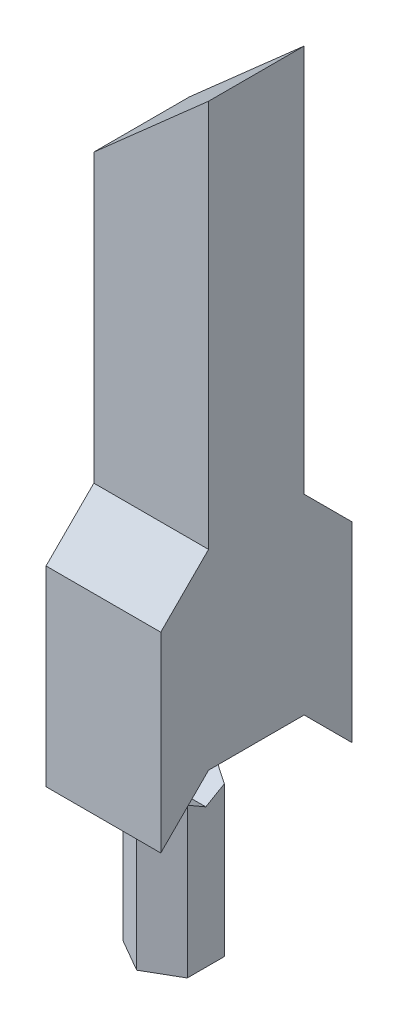
from build123d import *

# Parameters (mm, degrees)
BOSS_EXTRUDE1_DEPTH = 23
SKETCH2_R           = 2
CUT_EXTRUDE1_DEPTH  = 10
CUT_EXTRUDE2_DEPTH  = 4
BOSS_EXTRUDE2_DEPTH = 5
BOSS_EXTRUDE3_DEPTH = 12


with BuildPart() as part:
    # Sketch1 → Boss-Extrude1 (new body)
    with BuildSketch(Plane(origin=(0, 0, 0), x_dir=(1, 0, 0), z_dir=(0, 1, 0))):
        Polygon((0, -3.875), (3.35584844, -1.9375), (3.35584844, 1.9375), (0, 3.875), (-3.35584844, 1.9375), (-3.35584844, -1.9375), align=None)
    extrude(amount=-BOSS_EXTRUDE1_DEPTH)

    # Sketch2 → Cut-Extrude1 (cut)
    with BuildSketch(Plane.ZY.offset(3.35584844)):
        with Locations(Location((0, -5, 0), (0, 0, 14.361511563))):
            Circle(SKETCH2_R)
    extrude(amount=-CUT_EXTRUDE1_DEPTH, mode=Mode.SUBTRACT)

    # Sketch3 → Cut-Extrude2 (cut)
    with BuildSketch(Plane(origin=(3.35584844, 0, 0), x_dir=(0, 0, -1), z_dir=(1, 0, 0))):
        Polygon((0, -8.464101615), (3, -6.732050808), (3, -3.267949192), (0, -1.535898385), (-3, -3.267949192), (-3, -6.732050808), align=None)
    extrude(amount=-CUT_EXTRUDE2_DEPTH, mode=Mode.SUBTRACT)

    # Sketch4 → Boss-Extrude2 (add, symmetric)
    with BuildSketch(Plane.XY):
        Polygon((-3.35584844, 0), (-3.35584844, 50), (8.64415156, 60.606601718), (8.64415156, 0), align=None)
    extrude(amount=BOSS_EXTRUDE2_DEPTH, both=True)

    # Sketch5 → Boss-Extrude3 (add)
    with BuildSketch(Plane.ZY.offset(3.35584844)):
        Polygon((5, 0), (10, -5), (10, 15.003286349), (5, 20.003286349), align=None)
        Polygon((-10, 15.003286349), (-5, 20.003286349), (-5, 0), (-10, -5), align=None)
    extrude(amount=-BOSS_EXTRUDE3_DEPTH)


solid = part.part
